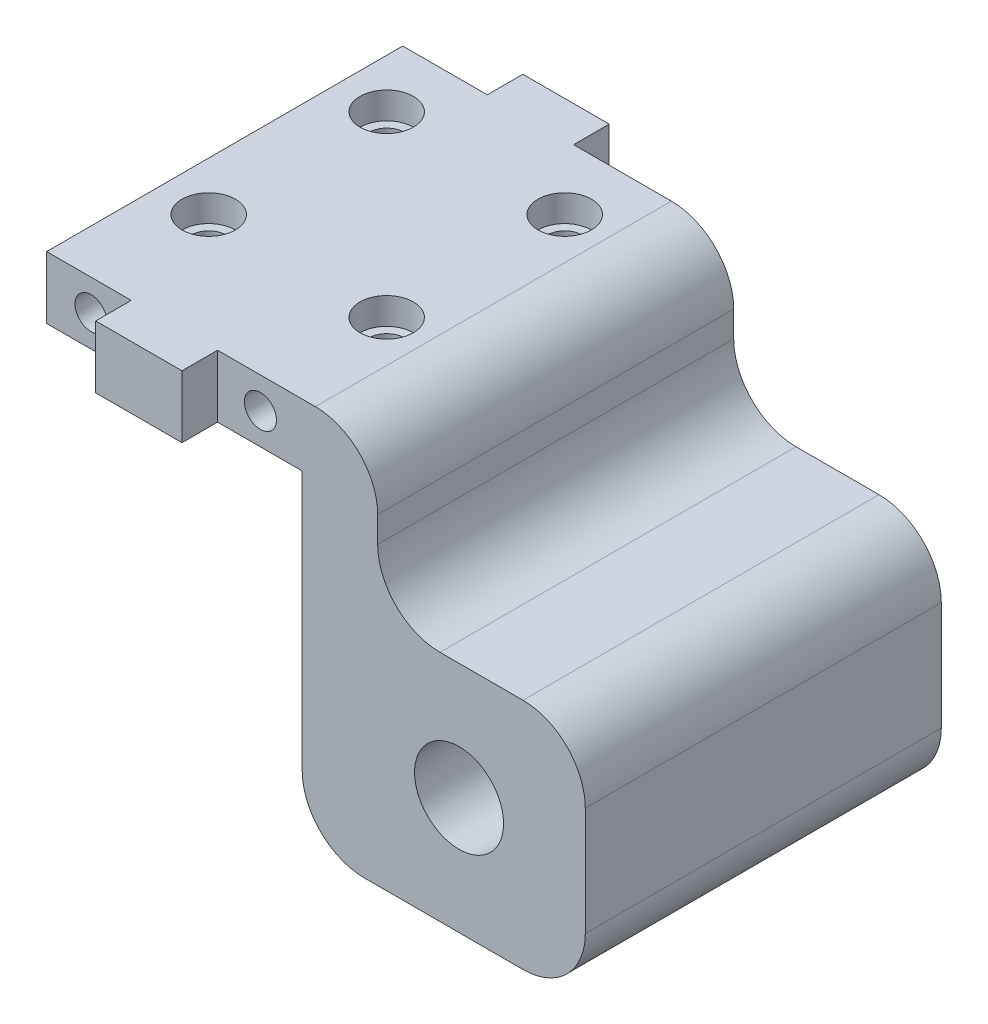
from build123d import *

# Parameters (mm, degrees)
BOSS_EXTRUDE1_DEPTH = 40
CUT_EXTRUDE1_START  = -40
SKETCH2_R           = 10.8
SKETCH2_R_2         = 5
CUT_EXTRUDE1_DEPTH  = 5
SKETCH2_3_R         = 5
CUT_EXTRUDE2_DEPTH  = 74.759130645
CUT_EXTRUDE3_START  = -40
SKETCH3_R           = 2
CUT_EXTRUDE3_DEPTH  = 15
SKETCH5_R           = 2
CUT_EXTRUDE4_DEPTH  = 72.940583606
FILLET1_R           = 7
SKETCH12_R          = 1.75
CUT_EXTRUDE11_DEPTH = 4
SKETCH14_R          = 3
CUT_EXTRUDE12_DEPTH = 3
SKETCH15_R          = 1.8
CUT_EXTRUDE13_DEPTH = 9
SKETCH16_W          = 40
SKETCH16_H          = 7
BOSS_EXTRUDE5_DEPTH = 2
SKETCH18_W          = 9.7
SKETCH18_H          = 7
BOSS_EXTRUDE6_DEPTH = 4


with BuildPart() as part:
    # Sketch1 → Boss-Extrude1 (new body)
    with BuildSketch(Plane.XY):
        Polygon((-10.843639069, 3.5), (-10.843639069, -3.5), (15.856339325, -3.5), (15.856339325, -39.601683417), (47.6667182, -39.601683417), (47.6667182, -13.398324584), (24.342902039, -13.398324584), (24.342902039, 3.5), align=None)
    extrude(amount=BOSS_EXTRUDE1_DEPTH)

    # Sketch2 → Cut-Extrude1 (cut)
    # profile 1 of 2: a face of its own
    with BuildSketch(Plane.XY.offset(40).offset(CUT_EXTRUDE1_START)):
        with Locations(Location((33.48398225, -26.500004001, 0), (0, 0, 180))):
            Circle(SKETCH2_R)
        with Locations((33.48398225, -26.500004001)):
            Circle(SKETCH2_R_2, mode=Mode.SUBTRACT)
    # profile 2 of 2: a face of its own
    with BuildSketch(Plane.XY.offset(40).offset(CUT_EXTRUDE1_START)):
        with Locations((33.48398225, -26.500004001)):
            Circle(SKETCH2_R_2)
    extrude(amount=CUT_EXTRUDE1_DEPTH, mode=Mode.SUBTRACT)

    # Sketch2<3> → Cut-Extrude2 (cut, through all)
    with BuildSketch(Plane.XY.offset(40)):
        with Locations((33.48398225, -26.500004001)):
            Circle(SKETCH2_3_R)
    extrude(amount=-CUT_EXTRUDE2_DEPTH, mode=Mode.SUBTRACT)

    # Sketch3 → Cut-Extrude3 (cut)
    with BuildSketch(Plane.XY.offset(40).offset(CUT_EXTRUDE3_START)):
        with Locations(Location((33.608608886, -34.499033204, 0), (0, 0, 180))):
            Circle(SKETCH3_R)
        with Locations(Location((25.484953047, -26.624630636, 0), (0, 0, 180))):
            Circle(SKETCH3_R)
        with Locations(Location((33.359355615, -18.500974797, 0), (0, 0, 180))):
            Circle(SKETCH3_R)
        with Locations(Location((41.483011454, -26.375377365, 0), (0, 0, 180))):
            Circle(SKETCH3_R)
    extrude(amount=CUT_EXTRUDE3_DEPTH, mode=Mode.SUBTRACT)

    # Sketch5 → Cut-Extrude4 (cut, through all)
    with BuildSketch(Plane.XZ.offset(3.5)):
        with Locations(Location((-7.343649872, 7.3, 0), (0, 0, 270))):
            Circle(SKETCH5_R)
        with Locations(Location((12.656350128, 7.3, 0), (0, 0, 270))):
            Circle(SKETCH5_R)
        with Locations(Location((-7.343649872, 27.3, 0), (0, 0, 270))):
            Circle(SKETCH5_R)
        with Locations(Location((12.656350128, 27.3, 0), (0, 0, 270))):
            Circle(SKETCH5_R)
    extrude(amount=-CUT_EXTRUDE4_DEPTH, mode=Mode.SUBTRACT)

    # Fillet1
    fillet1_edges = [part.edges().sort_by_distance(p)[0] for p in [
        (24.342902039, 3.5, 20),
        (24.342902039, -13.398324584, 20),
        (47.6667182, -13.398324584, 20),
        (47.6667182, -39.601683417, 20),
        (15.856339325, -39.601683417, 20),
    ]]
    fillet(fillet1_edges, radius=FILLET1_R)

    # Sketch12 → Cut-Extrude11 (cut)
    with BuildSketch(Plane(origin=(0, 0, 0), x_dir=(-1, 0, 0), z_dir=(0, 0, -1))):
        with Locations((-11.169959988, 0)):
            Circle(SKETCH12_R)
        with Locations((7.861665279, 0)):
            Circle(SKETCH12_R)
    extrude(amount=-CUT_EXTRUDE11_DEPTH, mode=Mode.SUBTRACT)

    # Sketch14 → Cut-Extrude12 (cut)
    with BuildSketch(Plane(origin=(0, 3.5, 0), x_dir=(1, 0, 0), z_dir=(0, 1, 0))):
        with Locations(Location((-7.343649872, -7.3, 0), (0, 0, 270))):
            Circle(SKETCH14_R)
        with Locations(Location((-7.343649872, -27.3, 0), (0, 0, 270))):
            Circle(SKETCH14_R)
        with Locations(Location((12.656350128, -27.3, 0), (0, 0, 270))):
            Circle(SKETCH14_R)
        with Locations(Location((12.656350128, -7.3, 0), (0, 0, 270))):
            Circle(SKETCH14_R)
    extrude(amount=-CUT_EXTRUDE12_DEPTH, mode=Mode.SUBTRACT)

    # Sketch15 → Cut-Extrude13 (cut)
    with BuildSketch(Plane.XY.offset(40)):
        with Locations((-7.861665279, 0)):
            Circle(SKETCH15_R)
        with Locations((11.169959988, 0)):
            Circle(SKETCH15_R)
    extrude(amount=-CUT_EXTRUDE13_DEPTH, mode=Mode.SUBTRACT)

    # Sketch16 → Boss-Extrude5 (add)
    with BuildSketch(Plane.ZY.offset(10.843639069)):
        with Locations((20, 0)):
            Rectangle(SKETCH16_W, SKETCH16_H)
    extrude(amount=BOSS_EXTRUDE5_DEPTH)

    # Sketch18 → Boss-Extrude6 (add)
    with BuildSketch(Plane(origin=(0, 0, 0), x_dir=(-1, 0, 0), z_dir=(0, 0, -1))):
        with Locations((-1.506350128, 0)):
            Rectangle(SKETCH18_W, SKETCH18_H)
    boss_extrude6 = extrude(amount=BOSS_EXTRUDE6_DEPTH)

    # Mirror6: Boss-Extrude6 across plane
    add(boss_extrude6.mirror(Plane(origin=(0, 0, 20), x_dir=(1, 0, 0), z_dir=(0, 0, -1))))


solid = part.part
